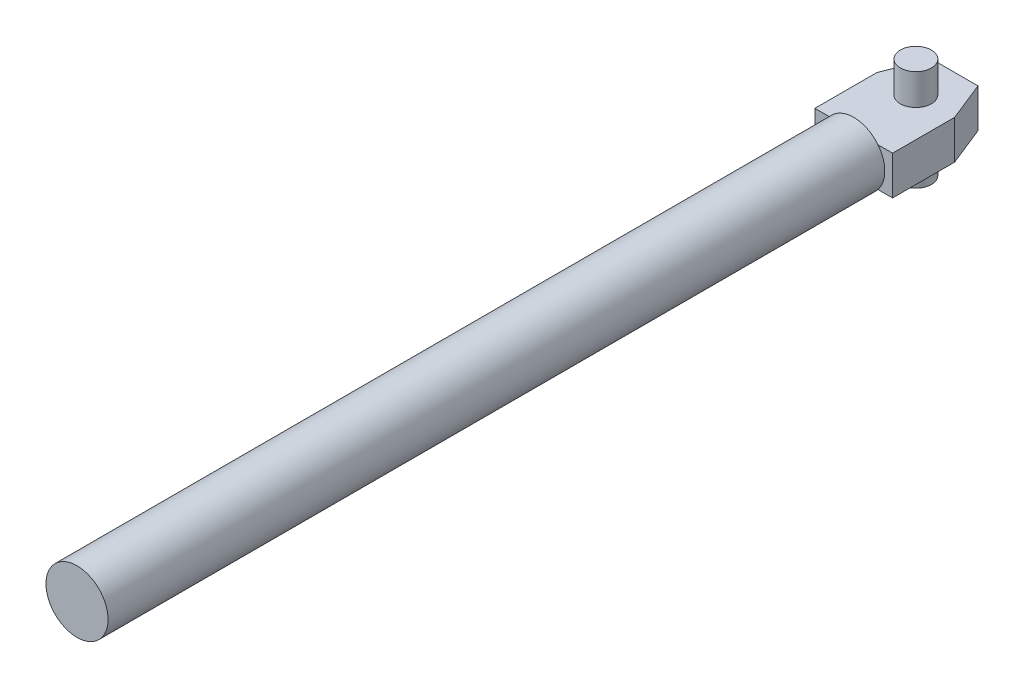
from build123d import *

# Parameters (mm, degrees)
SKETCH1_R                = 20
BOSS_EXTRUDE1_DEPTH      = 500
BOSS_EXTRUDE6_DEPTH      = 12.5
BOSS_EXTRUDE7_DEPTH      = 20
BOSS_EXTRUDE7_DEPTH_BACK = 45
SKETCH6_R                = 10


with BuildPart() as part:
    # Sketch1 → Boss-Extrude1 (new body)
    with BuildSketch(Plane.XY):
        Circle(SKETCH1_R)
    extrude(amount=BOSS_EXTRUDE1_DEPTH)

    # Sketch2 → Boss-Extrude6 (add, symmetric)
    with BuildSketch(Plane(origin=(0, 0, 0), x_dir=(1, 0, 0), z_dir=(0, 1, 0))):
        Polygon((-25, 40), (-15, 65), (15, 65), (25, 40), (25, 0), (-25, 0), align=None)
    extrude(amount=BOSS_EXTRUDE6_DEPTH, both=True)

    # Sketch6 → Boss-Extrude7 (add, two sides: drawn at the far end of the back side and taken through both)
    with BuildSketch(Plane(origin=(0, 12.5, 0), x_dir=(1, 0, 0), z_dir=(0, 1, 0)).offset(-BOSS_EXTRUDE7_DEPTH_BACK)):
        with Locations(Location((0, 40, 0), (0, 0, 270))):
            Circle(SKETCH6_R)
    extrude(amount=BOSS_EXTRUDE7_DEPTH + BOSS_EXTRUDE7_DEPTH_BACK)


solid = part.part
